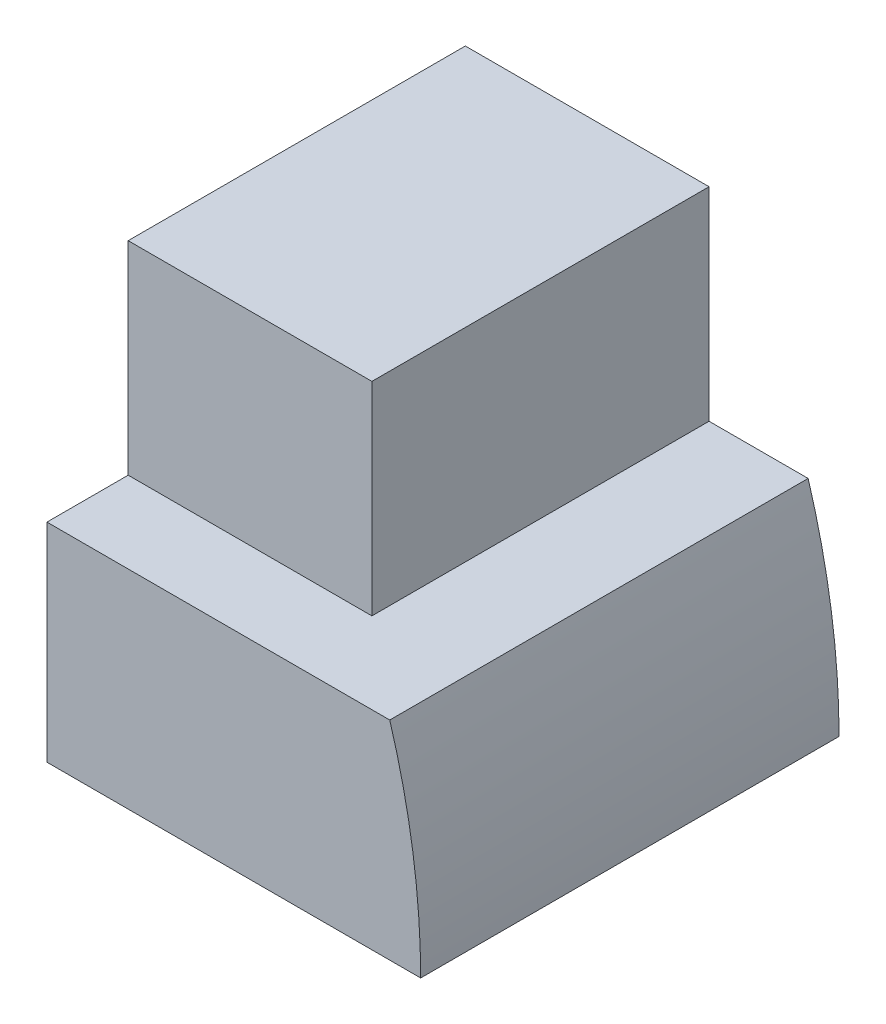
from build123d import *

# Parameters (mm, degrees)
EXTRUDE_1_DEPTH     = 5150
SKETCH_3_W          = 1000
SKETCH_3_H          = 2500
CUT_EXTRUDE_1_DEPTH = 8561.73010905


with BuildPart() as part:
    # Эскиз2 → Бобышка-Вытянуть1 (new body)
    with BuildSketch(Plane.XY):
        with BuildLine():
            Line((4201.125, 5060), (7201.125, 5060))
            Line((7201.125, 5060), (7201.125, 2560))
            Line((7201.125, 2560), (8420.582002785, 2560))
            ThreePointArc((8420.582002785, 2560), (8705.469431481, 1294.064620945), (8801.125, 0))
            Line((8801.125, 0), (4201.125, 0))
            Line((4201.125, 0), (4201.125, 5060))
        make_face()
    extrude(amount=EXTRUDE_1_DEPTH)

    # Эскиз3 → Вырез-Вытянуть1 (cut, through all)
    with BuildSketch(Plane.ZY.offset(-4201.125)):
        with Locations((4650, 3810)):
            Rectangle(SKETCH_3_W, SKETCH_3_H)
    extrude(amount=-CUT_EXTRUDE_1_DEPTH, mode=Mode.SUBTRACT)


solid = part.part
